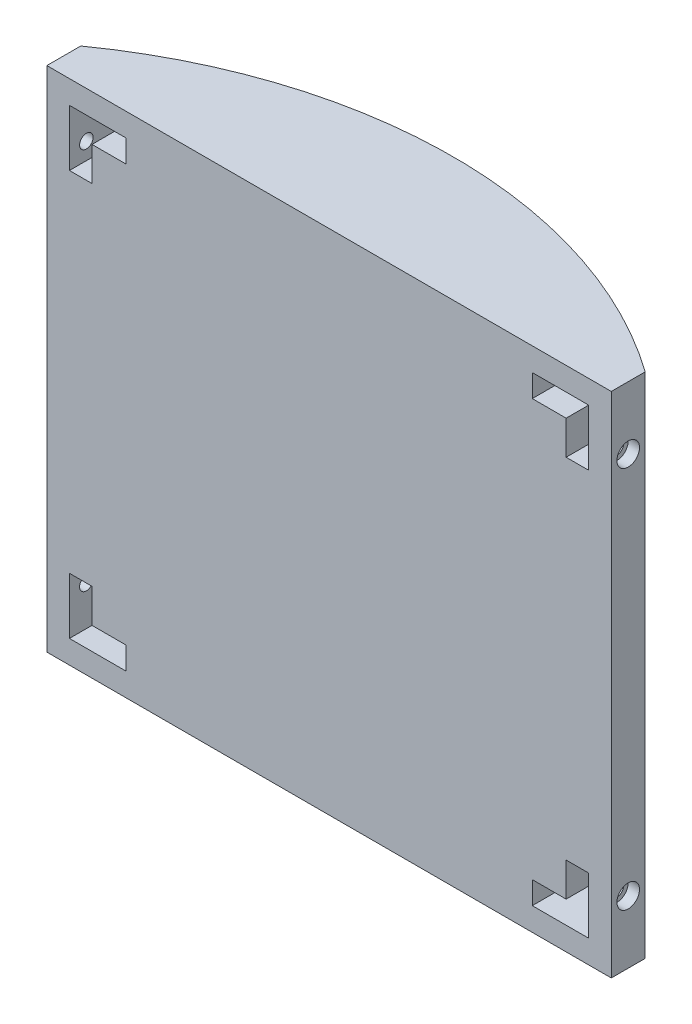
from build123d import *

# Parameters (mm, degrees)
EXTRUDE_1_DEPTH     = 45
SKETCH_5_W          = 2
SKETCH_5_H          = 2
SKETCH_5_W_2        = 3
SKETCH_5_H_2        = 3
CUT_EXTRUDE_1_DEPTH = 4
SKETCH_6_R          = 0.6
CUT_EXTRUDE_2_DEPTH = 2
SKETCH_6_3_R        = 1
CUT_EXTRUDE_3_DEPTH = 1
CUT_EXTRUDE_START   = -48
SKETCH_6_4_R        = 0.6
CUT_EXTRUDE_4_DEPTH = 2
CUT_EXTRUDE_START_2 = -49
SKETCH_6_5_R        = 1
CUT_EXTRUDE_6_DEPTH = 1


with BuildPart() as part:
    # 草图4 → 凸台-拉伸1 (new body)
    with BuildSketch(Plane(origin=(0, 0, 0), x_dir=(1, 0, 0), z_dir=(0, 1, 0))):
        with BuildLine():
            Line((-25, 0), (-25, -3))
            Line((-25, -3), (25, -3))
            Line((25, -3), (25, 0))
            ThreePointArc((25, 0), (0, 8), (-25, 0))
        make_face()
    extrude(amount=EXTRUDE_1_DEPTH)

    # 草图5 → 切除-拉伸1 (cut)
    with BuildSketch(Plane.XY.offset(3)):
        with Locations((-22, 41.95)):
            Rectangle(SKETCH_5_W, SKETCH_5_H)
        with Locations((-19.5, 41.95)):
            Rectangle(SKETCH_5_W_2, SKETCH_5_H)
        with Locations((-22, 39.45)):
            Rectangle(SKETCH_5_W, SKETCH_5_H_2)
        with Locations((22, 41.95)):
            Rectangle(SKETCH_5_W, SKETCH_5_H)
        with Locations((19.5, 41.95)):
            Rectangle(SKETCH_5_W_2, SKETCH_5_H)
        with Locations((22, 39.45)):
            Rectangle(SKETCH_5_W, SKETCH_5_H_2)
        with Locations((-22, 3.05)):
            Rectangle(SKETCH_5_W, SKETCH_5_H)
        with Locations((-19.5, 3.05)):
            Rectangle(SKETCH_5_W_2, SKETCH_5_H)
        with Locations((-22, 5.55)):
            Rectangle(SKETCH_5_W, SKETCH_5_H_2)
        with Locations((22, 3.05)):
            Rectangle(SKETCH_5_W, SKETCH_5_H)
        with Locations((19.5, 3.05)):
            Rectangle(SKETCH_5_W_2, SKETCH_5_H)
        with Locations((22, 5.55)):
            Rectangle(SKETCH_5_W, SKETCH_5_H_2)
    extrude(amount=-CUT_EXTRUDE_1_DEPTH, mode=Mode.SUBTRACT)

    # 草图6 → 切除-拉伸2 (cut)
    with BuildSketch(Plane.ZY.offset(25)):
        with Locations((1.5, 5.55)):
            Circle(SKETCH_6_R)
        with Locations((1.5, 39.45)):
            Circle(SKETCH_6_R)
    extrude(amount=-CUT_EXTRUDE_2_DEPTH, mode=Mode.SUBTRACT)

    # 草图6<3> → 切除-拉伸3 (cut)
    with BuildSketch(Plane.ZY.offset(25)):
        with Locations((1.5, 5.55)):
            Circle(SKETCH_6_3_R)
        with Locations((1.5, 39.45)):
            Circle(SKETCH_6_3_R)
    extrude(amount=-CUT_EXTRUDE_3_DEPTH, mode=Mode.SUBTRACT)

    # 草图6<4> → 切除-拉伸4 (cut)
    with BuildSketch(Plane.ZY.offset(25).offset(CUT_EXTRUDE_START)):
        with Locations((1.5, 5.55)):
            Circle(SKETCH_6_4_R)
        with Locations((1.5, 39.45)):
            Circle(SKETCH_6_4_R)
    extrude(amount=-CUT_EXTRUDE_4_DEPTH, mode=Mode.SUBTRACT)

    # 草图6<5> → 切除-拉伸6 (cut)
    with BuildSketch(Plane.ZY.offset(25).offset(CUT_EXTRUDE_START_2)):
        with Locations((1.5, 5.55)):
            Circle(SKETCH_6_5_R)
        with Locations((1.5, 39.45)):
            Circle(SKETCH_6_5_R)
    extrude(amount=-CUT_EXTRUDE_6_DEPTH, mode=Mode.SUBTRACT)


solid = part.part
